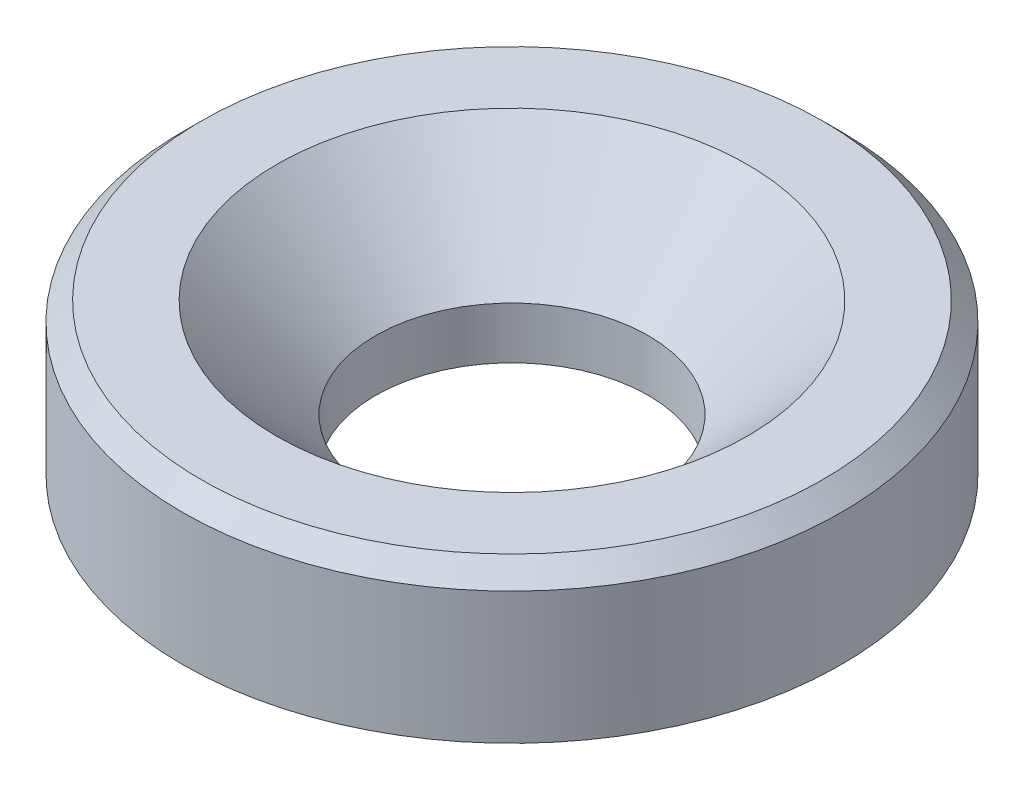
from build123d import *

# Parameters (mm, degrees)
CHAMFER1_SIZE = 1


with BuildPart() as part:
    # Sketch2 → Revolve1 (revolve)
    with BuildSketch(Plane.XY, mode=Mode.PRIVATE) as revolve1_sk:
        Polygon((12.5, 8), (7.25, 2.75), (7.25, 0), (17.5, 0), (17.5, 8), align=None)
    revolve(revolve1_sk.sketch.rotate(Axis((0, 11.452324261, 0), (0, -1, 0)), 90), axis=Axis((0, 11.452324261, 0), (0, -1, 0)))

    # Chamfer1
    chamfer1_edges = [part.edges().sort_by_distance(p)[0] for p in [
        (0, 8, -17.5),
    ]]
    chamfer(chamfer1_edges, length=CHAMFER1_SIZE)


solid = part.part
